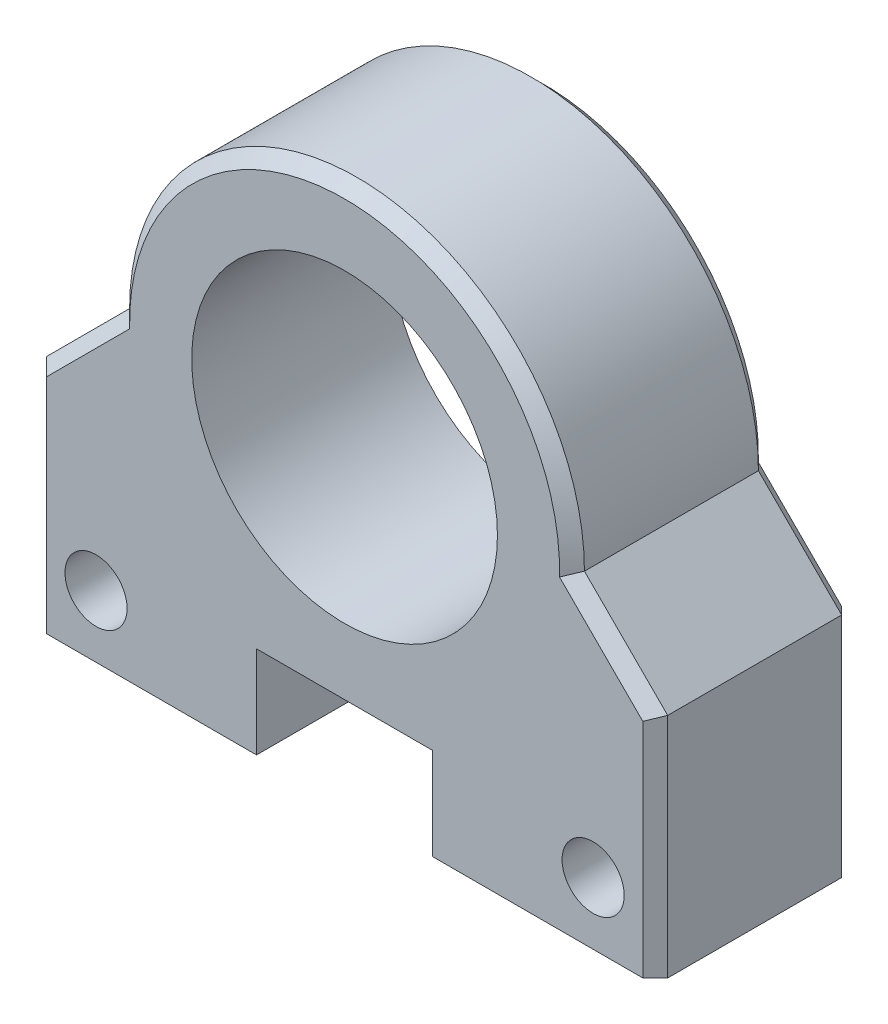
from build123d import *

# Parameters (mm, degrees)
SKETCH1_R           = 7.8105
BOSS_EXTRUDE1_DEPTH = 10.16
CHAMFER2_SIZE       = 0.635
SKETCH2_R           = 1.5875
CUT_EXTRUDE1_DEPTH  = 34.335322786


with BuildPart() as part:
    # Sketch1 → Boss-Extrude1 (new body)
    with BuildSketch(Plane.XY):
        with BuildLine():
            Line((4.5, 4.699), (-4.5, 4.699))
            Line((-4.5, 4.699), (-4.5, 0))
            Line((-4.5, 0), (-15.875, 0))
            Line((-15.875, 0), (-15.875, 11.6205))
            Line((-15.875, 11.6205), (-11.6205, 15.875))
            ThreePointArc((-11.6205, 15.875), (0, 27.4955), (11.6205, 15.875))
            Line((11.6205, 15.875), (15.875, 11.6205))
            Line((15.875, 11.6205), (15.875, 0))
            Line((15.875, 0), (4.5, 0))
            Line((4.5, 0), (4.5, 4.699))
        make_face()
        with Locations((0, 15.875)):
            Circle(SKETCH1_R, mode=Mode.SUBTRACT)
    extrude(amount=BOSS_EXTRUDE1_DEPTH)

    # Chamfer2
    chamfer2_edges = [part.edges().sort_by_distance(p)[0] for p in [
        (-13.74775, 13.74775, 0),
        (0, 27.4955, 0),
        (13.74775, 13.74775, 0),
        (15.875, 5.81025, 0),
        (15.875, 5.81025, 10.16),
        (13.74775, 13.74775, 10.16),
        (0, 27.4955, 10.16),
        (-13.74775, 13.74775, 10.16),
        (-15.875, 5.81025, 10.16),
        (-15.875, 5.81025, 0),
    ]]
    chamfer(chamfer2_edges, length=CHAMFER2_SIZE)

    # Sketch2 → Cut-Extrude1 (cut, through all)
    with BuildSketch(Plane.XY.offset(10.16)):
        with Locations((-12.7, 3.175)):
            Circle(SKETCH2_R)
        with Locations(Location((12.7, 3.175, 0), (0, 0, 180))):
            Circle(SKETCH2_R)
    extrude(amount=-CUT_EXTRUDE1_DEPTH, mode=Mode.SUBTRACT)


solid = part.part
